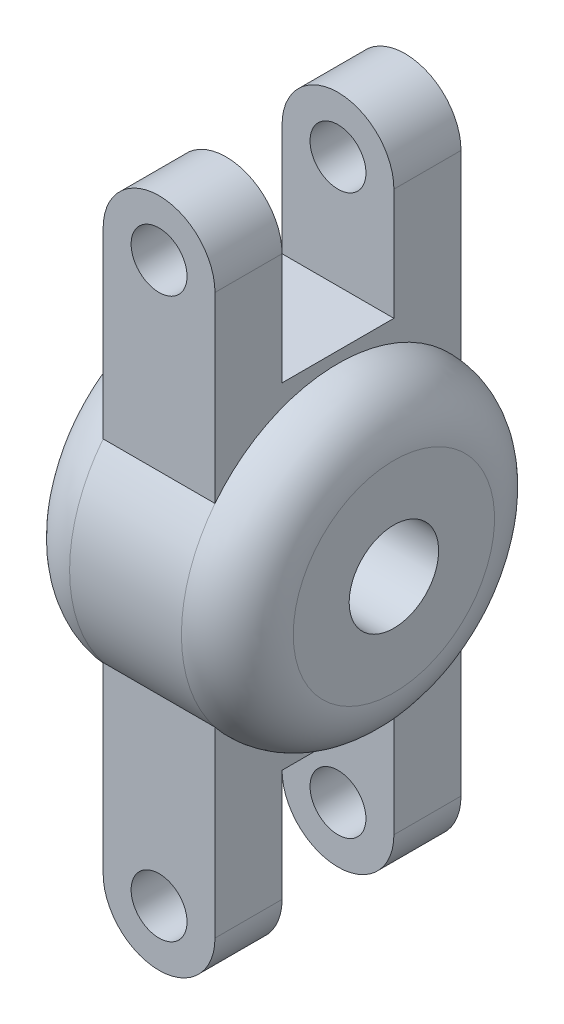
from build123d import *

# Parameters (mm, degrees)
SKETCH_2_R          = 2.5
EXTRUDE_1_DEPTH     = 11
CUT_EXTRUDE_1_DEPTH = 5


with BuildPart() as part:
    # 草图2 → 凸台-拉伸1 (new, symmetric)
    with BuildSketch(Plane.XY):
        with BuildLine():
            Line((44.052861038, 4), (34.052861038, 4))
            Line((34.052861038, 4), (34.052861038, 25))
            ThreePointArc((34.052861038, 25), (39.052861038, 30), (44.052861038, 25))
            Line((44.052861038, 25), (44.052861038, 4))
        make_face()
        with Locations((39.052861038, 25)):
            Circle(SKETCH_2_R, mode=Mode.SUBTRACT)
    extrude_1 = extrude(amount=EXTRUDE_1_DEPTH, both=True)

    # 草图3 → 旋转2 (revolve)
    with BuildSketch(Plane.XY, mode=Mode.PRIVATE) as revolve_2_sk:
        with BuildLine():
            Line((29.052861038, 4), (49.052861038, 4))
            Line((49.052861038, 4), (49.052861038, 9))
            ThreePointArc((49.052861038, 9), (47.588394944, 12.535533906), (44.052861038, 14))
            Line((44.052861038, 14), (34.052861038, 14))
            ThreePointArc((34.052861038, 14), (30.517327132, 12.535533906), (29.052861038, 9))
            Line((29.052861038, 9), (29.052861038, 4))
        make_face()
    revolve(revolve_2_sk.sketch.rotate(Axis((27.632077349, 0, 0), (1, 0, 0)), 90), axis=Axis((27.632077349, 0, 0), (1, 0, 0)))

    # 草图4 → 切除-拉伸1 (cut, symmetric)
    with BuildSketch(Plane.XY):
        with BuildLine():
            Line((44.052861038, 15), (44.052861038, 25))
            ThreePointArc((44.052861038, 25), (39.052861038, 30), (34.052861038, 25))
            Line((34.052861038, 25), (34.052861038, 15))
            Line((34.052861038, 15), (44.052861038, 15))
        make_face()
    cut_extrude_1 = extrude(amount=CUT_EXTRUDE_1_DEPTH, both=True, mode=Mode.SUBTRACT)

    # 镜向3: 凸台-拉伸1, 切除-拉伸1 across plane
    add(extrude_1.mirror(Plane.ZX))
    add(cut_extrude_1.mirror(Plane.ZX), mode=Mode.SUBTRACT)


solid = part.part
